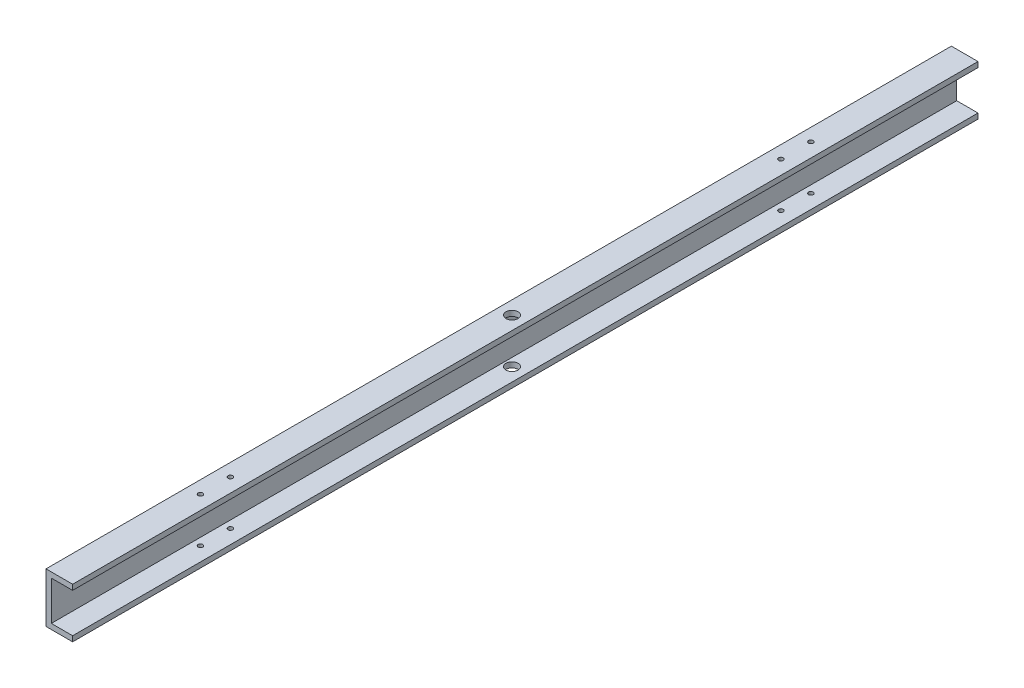
from build123d import *

# Parameters (mm, degrees)
BOSS_EXTRUDE1_DEPTH = 1360
SKETCH2_R           = 3.5
SKETCH2_R_2         = 9
CUT_EXTRUDE1_DEPTH  = 814.403343981


with BuildPart() as part:
    # Sketch1 → Boss-Extrude1 (new body)
    with BuildSketch(Plane.XY.offset(-680)):
        Polygon((-440, 550), (-440, 625), (-400, 625), (-400, 617), (-432, 617), (-432, 558), (-400, 558), (-400, 550), align=None)
    extrude(amount=BOSS_EXTRUDE1_DEPTH)

    # Sketch2 → Cut-Extrude1 (cut, through all)
    with BuildSketch(Plane(origin=(0, 625, 0), x_dir=(1, 0, 0), z_dir=(0, 1, 0))):
        with Locations(Location((-421, -467, 0), (0, 0, 270))):
            Circle(SKETCH2_R)
        with Locations(Location((-421, -422, 0), (0, 0, 270))):
            Circle(SKETCH2_R)
        with Locations(Location((-420, 0, 0), (0, 0, 270))):
            Circle(SKETCH2_R_2)
        with Locations(Location((-421, 450, 0), (0, 0, 270))):
            Circle(SKETCH2_R)
        with Locations(Location((-421, 405, 0), (0, 0, 270))):
            Circle(SKETCH2_R)
    extrude(amount=-CUT_EXTRUDE1_DEPTH, mode=Mode.SUBTRACT)


solid = part.part
